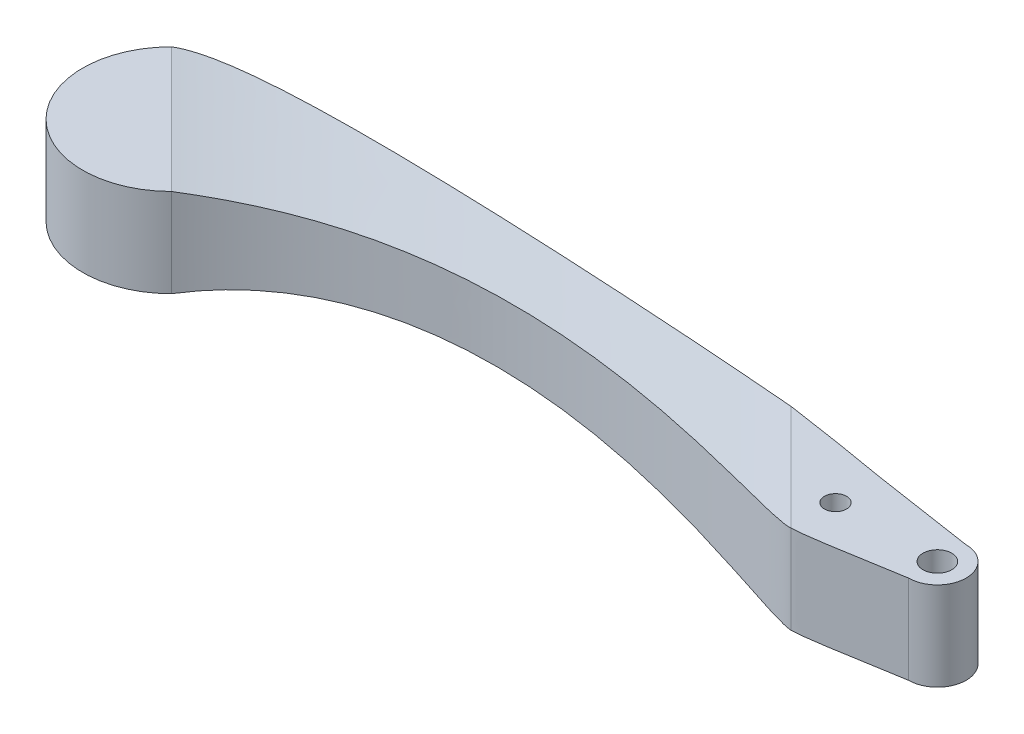
from build123d import *

# Parameters (mm, degrees)
BOSS_EXTRUDE1_DEPTH      = 20
BOSS_EXTRUDE1_DEPTH_BACK = 20
SKETCH1_R                = 5
SKETCH1_R_2              = 6.5
CUT_EXTRUDE2_DEPTH       = 343.928564136
CUT_EXTRUDE2_DEPTH_BACK  = 343.928564136


with BuildPart() as part:
    # Sketch1 → Boss-Extrude1 (new, two sides: drawn at the far end of the back side and taken through both)
    with BuildSketch(Plane(origin=(0, 0, 0), x_dir=(1, 0, 0), z_dir=(0, 1, 0)).offset(-BOSS_EXTRUDE1_DEPTH_BACK)):
        with BuildLine():
            ThreePointArc((-328.284271247, 28.284271247), (-328.284271247, -28.284271247), (-271.715728753, -28.284271247))
            add(Edge.make_bspline(
                [(-271.715728753, -28.284271247), (-189.219937614, 54.211519891), (-20, -20), (3.938998468, -20), (19.272331802, -17.666666667), (46, -13)],
                knots=[0, 0, 0, 0, 1, 1, 1.196949923, 1.196949923, 1.196949923, 1.196949923], degree=3))
            ThreePointArc((46, -13), (59, 0), (46, 13))
            add(Edge.make_bspline(
                [(46, 13), (0.03150303, 20), (0, 20)],
                knots=[0.358766717, 0.358766717, 0.358766717, 1.358766717, 1.358766717, 1.358766717], degree=2))
            add(Edge.make_bspline(
                [(0, 20), (-114.873131821, 40.378289836), (-300, 56.568542495), (-328.284271247, 28.284271247)],
                knots=[0.1900067, 0.1900067, 0.1900067, 0.1900067, 1.1900067, 1.1900067, 1.1900067, 1.1900067], degree=3))
        make_face()
        Circle(SKETCH1_R, mode=Mode.SUBTRACT)
        with Locations((46, 0)):
            Circle(SKETCH1_R_2, mode=Mode.SUBTRACT)
    extrude(amount=BOSS_EXTRUDE1_DEPTH + BOSS_EXTRUDE1_DEPTH_BACK)

    # Sketch3 → Cut-Extrude2 (cut, two sides: drawn at the far end of the back side and taken through both)
    with BuildSketch(Plane(origin=(-71.299423149, 0, -172.132034356), x_dir=(0.7071067811865464, 0, -0.7071067811865488), z_dir=(0.7071067811865488, 0, 0.7071067811865464)).offset(-CUT_EXTRUDE2_DEPTH_BACK)):
        with BuildLine():
            add(Edge.make_bspline(
                [(-283.431457505, -20), (-227.543374676, -10.63873359), (-151.71769793, -12.794597658), (-85.441558773, -20)],
                knots=[0, 0, 0, 0, 1, 1, 1, 1], degree=3))
            Line((-283.431457505, -20), (-85.441558773, -20))
        make_face()
        with BuildLine():
            Line((-85.441558773, 20), (-283.431457505, 20))
            add(Edge.make_bspline(
                [(-283.431457505, 20), (-227.543374676, 10.63873359), (-151.71769793, 12.794597658), (-85.441558773, 20)],
                knots=[0, 0, 0, 0, 1, 1, 1, 1], degree=3))
        make_face()
    extrude(amount=CUT_EXTRUDE2_DEPTH + CUT_EXTRUDE2_DEPTH_BACK, mode=Mode.SUBTRACT)


solid = part.part
